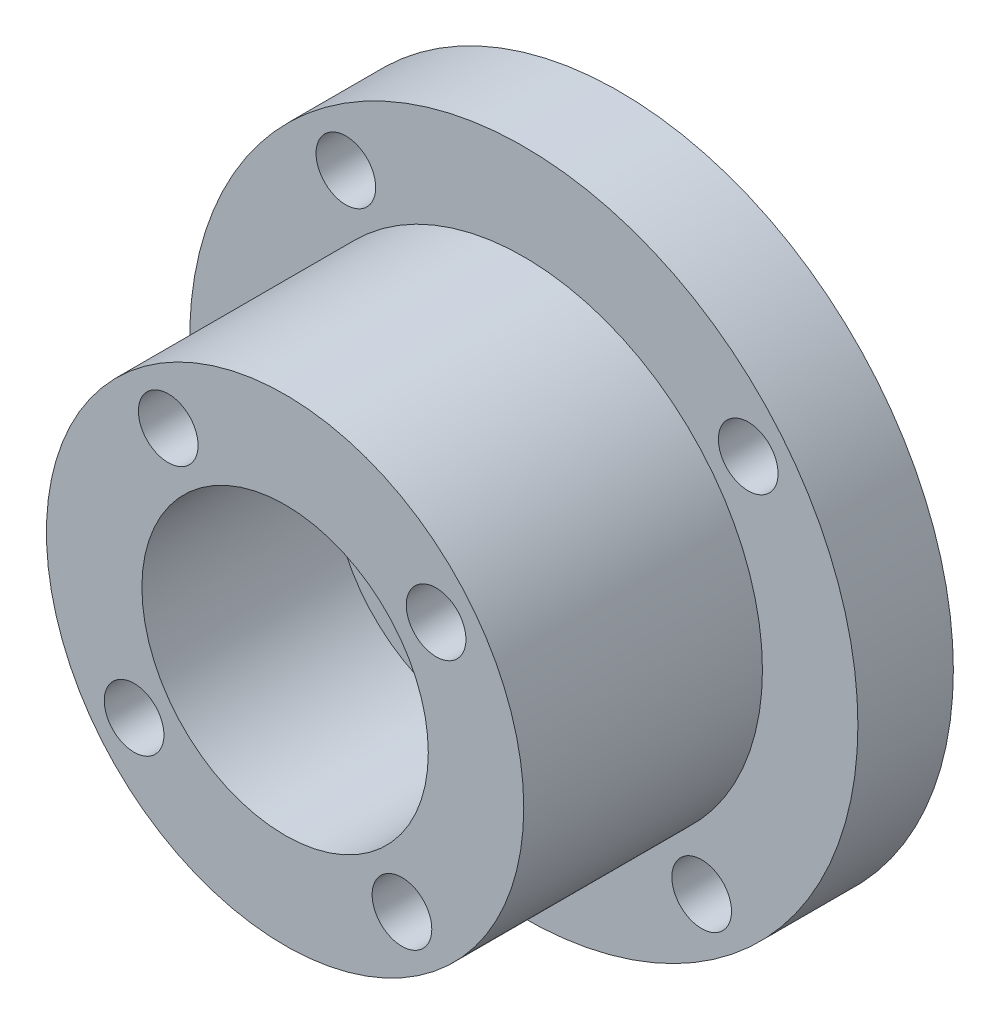
from build123d import *

# Parameters (mm, degrees)
SKETCH_1_R          = 14
EXTRUDE_1_DEPTH     = 4
SKETCH_2_R          = 10
EXTRUDE_2_DEPTH     = 10
SKETCH_3_R          = 2.5
CUT_EXTRUDE_1_DEPTH = 25.248711306
SKETCH_4_R          = 6
CUT_EXTRUDE_2_DEPTH = 8
SKETCH_5_R          = 1.25
CUT_EXTRUDE_3_DEPTH = 8
SKETCH_6_R          = 1.25
CUT_EXTRUDE_4_DEPTH = 5


with BuildPart() as part:
    # 草图1 → 凸台-拉伸1 (new body)
    with BuildSketch(Plane.XY):
        Circle(SKETCH_1_R)
    extrude(amount=EXTRUDE_1_DEPTH)

    # 草图2 → 凸台-拉伸2 (add)
    with BuildSketch(Plane.XY.offset(4)):
        Circle(SKETCH_2_R)
    extrude(amount=EXTRUDE_2_DEPTH)

    # 草图3 → 切除-拉伸1 (cut, through all)
    with BuildSketch(Plane.XY.offset(14)):
        Circle(SKETCH_3_R)
    extrude(amount=-CUT_EXTRUDE_1_DEPTH, mode=Mode.SUBTRACT)

    # 草图4 → 切除-拉伸2 (cut)
    with BuildSketch(Plane.XY.offset(14)):
        Circle(SKETCH_4_R)
    extrude(amount=-CUT_EXTRUDE_2_DEPTH, mode=Mode.SUBTRACT)

    # 草图5 → 切除-拉伸3 (cut)
    with BuildSketch(Plane.XY.offset(4)):
        with Locations((-9.404150189, -7.453989484)):
            Circle(SKETCH_5_R)
        with Locations((-7.453989484, 9.404150189)):
            Circle(SKETCH_5_R)
        with Locations((9.404150189, 7.453989484)):
            Circle(SKETCH_5_R)
        with Locations((7.453989484, -9.404150189)):
            Circle(SKETCH_5_R)
    extrude(amount=-CUT_EXTRUDE_3_DEPTH, mode=Mode.SUBTRACT)

    # 草图6 → 切除-拉伸4 (cut)
    with BuildSketch(Plane.XY.offset(14)):
        with Locations((-6.326711752, -4.896194277)):
            Circle(SKETCH_6_R)
        with Locations((-4.896194277, 6.326711752)):
            Circle(SKETCH_6_R)
        with Locations((6.326711752, 4.896194277)):
            Circle(SKETCH_6_R)
        with Locations((4.896194277, -6.326711752)):
            Circle(SKETCH_6_R)
    extrude(amount=-CUT_EXTRUDE_4_DEPTH, mode=Mode.SUBTRACT)


solid = part.part
